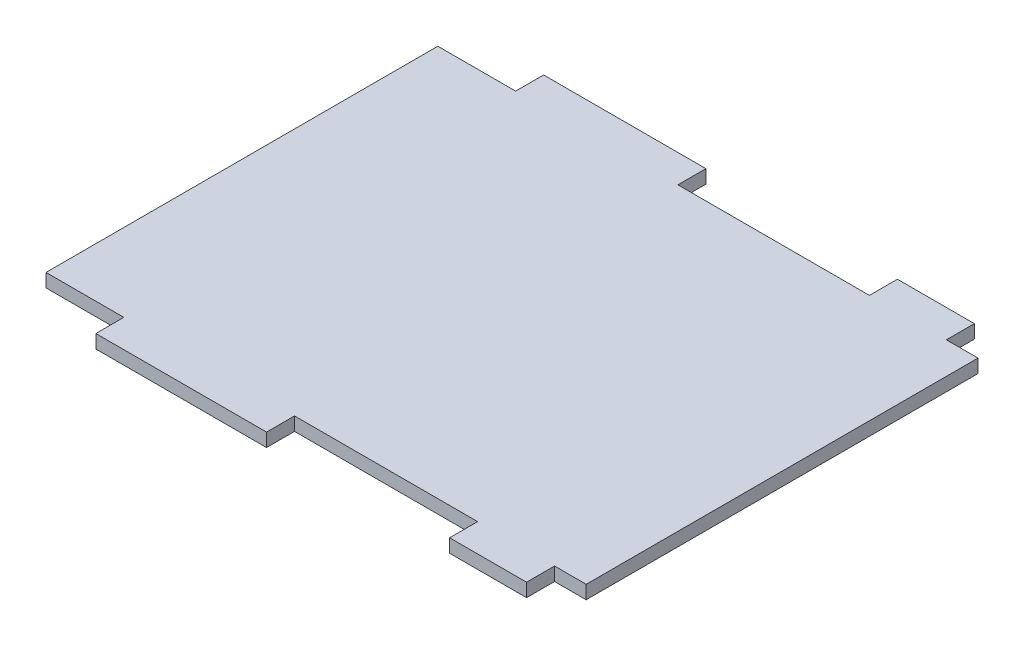
from build123d import *

# Parameters (mm, degrees)
SKETCH1_W           = 193
SKETCH1_H           = 140
SKETCH1_W_2         = 57.981722711
SKETCH1_H_2         = 10
SKETCH1_W_3         = 27.482762279
SKETCH1_W_4         = 61
BOSS_EXTRUDE1_DEPTH = 4.8


with BuildPart() as part:
    # Sketch1 → Boss-Extrude1 (new body)
    with BuildSketch(Plane(origin=(0, 0, 0), x_dir=(1, 0, 0), z_dir=(0, 1, 0))):
        Rectangle(SKETCH1_W, SKETCH1_H)
        with Locations((-39.709138645, 75)):
            Rectangle(SKETCH1_W_2, SKETCH1_H_2)
        with Locations((71.455181925, 75)):
            Rectangle(SKETCH1_W_3, SKETCH1_H_2)
        with Locations((71.455181925, -75)):
            Rectangle(SKETCH1_W_3, SKETCH1_H_2)
        with Locations((-38.2, -75)):
            Rectangle(SKETCH1_W_4, SKETCH1_H_2)
    extrude(amount=BOSS_EXTRUDE1_DEPTH)


solid = part.part
